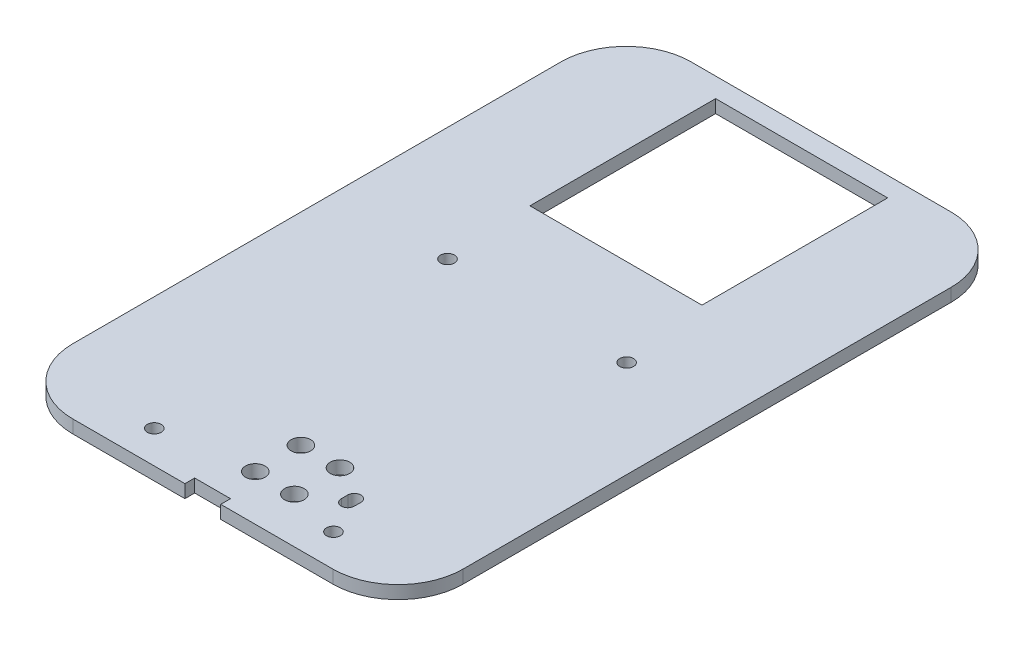
from build123d import *

# Parameters (mm, degrees)
TOP_DEPTH                 = 2.54
SKETCH7_R                 = 1.905
BUTTONLEDCUT_DEPTH        = 72.306909304
SKETCH8_W                 = 33.528
SKETCH8_H                 = 36.195
SOLARCUT_DEPTH            = 72.306909304
F_6_32_TAPPED_HOLE1_D     = 2.7051
F_6_32_TAPPED_HOLE1_DEPTH = 11.176
F_6_32_TAPPED_HOLE1_TIP   = 0.81269403
SKETCH13_W                = 12.446
SKETCH13_H                = 1.27
BODY_TABS_DEPTH           = 1.27
BODY_TABS_DRAFT           = 7
BODY_TABS_PROFILE_2_DEPTH = 1.27
BODY_TABS_PROFILE_2_DRAFT = 7
SKETCH14_W                = 6.985
SKETCH14_H                = 1.905
FLAT_HEAD_HOLE_DEPTH      = 73.383371188


with BuildPart() as part:
    # Sketch2 → top (new body)
    with BuildSketch(Plane(origin=(0, 0, 0), x_dir=(1, 0, 0), z_dir=(0, 1, 0))):
        with BuildLine():
            Line((-25.3365, -60.2615), (25.3365, -60.2615))
            ThreePointArc((25.3365, -60.2615), (34.316756121, -56.541756121), (38.0365, -47.5615))
            Line((38.0365, -47.5615), (38.0365, 47.5615))
            ThreePointArc((38.0365, 47.5615), (34.316756121, 56.541756121), (25.3365, 60.2615))
            Line((25.3365, 60.2615), (-25.3365, 60.2615))
            ThreePointArc((-25.3365, 60.2615), (-34.316756121, 56.541756121), (-38.0365, 47.5615))
            Line((-38.0365, 47.5615), (-38.0365, -47.5615))
            ThreePointArc((-38.0365, -47.5615), (-34.316756121, -56.541756121), (-25.3365, -60.2615))
        make_face()
    extrude(amount=TOP_DEPTH)

    # Sketch7 → ButtonLEDCut (cut, through all)
    with BuildSketch(Plane(origin=(0, 2.54, 0), x_dir=(1, 0, 0), z_dir=(0, 1, 0))):
        with Locations(Location((1.3335, -51.3715, 0), (0, 0, 270))):
            Circle(SKETCH7_R)
        with Locations(Location((8.9535, -51.3715, 0), (0, 0, 270))):
            Circle(SKETCH7_R)
        with Locations(Location((8.9535, -42.4815, 0), (0, 0, 270))):
            Circle(SKETCH7_R)
        with Locations(Location((1.3335, -42.4815, 0), (0, 0, 270))):
            Circle(SKETCH7_R)
        with BuildLine():
            Line((16.8275, -46.2915), (16.8275, -47.5615))
            ThreePointArc((16.8275, -47.5615), (15.5575, -48.8315), (14.2875, -47.5615))
            Line((14.2875, -47.5615), (14.2875, -46.2915))
            ThreePointArc((14.2875, -46.2915), (15.5575, -45.0215), (16.8275, -46.2915))
        make_face()
    extrude(amount=-BUTTONLEDCUT_DEPTH, mode=Mode.SUBTRACT)

    # Sketch8 → SolarCut (cut, through all)
    with BuildSketch(Plane(origin=(0, 2.54, 0), x_dir=(1, 0, 0), z_dir=(0, 1, 0))):
        with Locations((0, 38.354)):
            Rectangle(SKETCH8_W, SKETCH8_H)
    extrude(amount=-SOLARCUT_DEPTH, mode=Mode.SUBTRACT)

    # #6-32 Tapped Hole1
    with Locations(Plane(origin=(0, 2.54, 0), x_dir=(1, 0, 0), z_dir=(0, 1, 0))):
        with Locations((-15.8115, 3.2385), (19.1135, 3.2385), (19.1135, -53.9115), (-15.8115, -53.9115)):
            Hole(F_6_32_TAPPED_HOLE1_D / 2, depth=F_6_32_TAPPED_HOLE1_DEPTH)
            with Locations((0, 0, -(F_6_32_TAPPED_HOLE1_DEPTH + F_6_32_TAPPED_HOLE1_TIP / 2))):  # 118° drill point
                Cone(0, F_6_32_TAPPED_HOLE1_D / 2, F_6_32_TAPPED_HOLE1_TIP, mode=Mode.SUBTRACT)


with BuildPart() as body_tabs_tool:
    # Sketch13 → Body Tabs (with draft: the straight prism first)
    with BuildSketch(Plane(origin=(0, 0, -60.2615), x_dir=(-1, 0, 0), z_dir=(0, 0, -1))):
        with Locations((-12.7, 0.635)):
            Rectangle(SKETCH13_W, SKETCH13_H)
    extrude(amount=BODY_TABS_DEPTH)
    # Body Tabs: the draft: its side faces are tilted about the plane it starts from
    body_tabs_sides = [body_tabs_tool.faces().sort_by_distance(p)[0] for p in [
        (12.7, 0, -60.8965),
        (6.477, 0.635, -60.8965),
        (12.7, 1.27, -60.8965),
        (18.923, 0.635, -60.8965),
    ]]
    draft(body_tabs_sides, Plane(origin=(0, 0, -60.2615), x_dir=(-1, 0, 0), z_dir=(0, 0, -1)), BODY_TABS_DRAFT)


with BuildPart() as part_1:
    add(part.part)

    # Body Tabs: add body_tabs_tool
    add(body_tabs_tool.part)


with BuildPart() as body_tabs_profile_2_tool:
    # Sketch13 → Body Tabs profile 2 (with draft: the straight prism first)
    with BuildSketch(Plane(origin=(0, 0, -60.2615), x_dir=(-1, 0, 0), z_dir=(0, 0, -1))):
        with Locations((12.7, 0.635)):
            Rectangle(SKETCH13_W, SKETCH13_H)
    extrude(amount=BODY_TABS_PROFILE_2_DEPTH)
    # Body Tabs profile 2: the draft: its side faces are tilted about the plane it starts from
    body_tabs_profile_2_sides = [body_tabs_profile_2_tool.faces().sort_by_distance(p)[0] for p in [
        (-18.923, 0.635, -60.8965),
        (-12.7, 1.27, -60.8965),
        (-6.477, 0.635, -60.8965),
        (-12.7, 0, -60.8965),
    ]]
    draft(body_tabs_profile_2_sides, Plane(origin=(0, 0, -60.2615), x_dir=(-1, 0, 0), z_dir=(0, 0, -1)), BODY_TABS_PROFILE_2_DRAFT)


with BuildPart() as part_2:
    add(part_1.part)

    # Body Tabs profile 2: add body_tabs_profile_2_tool
    add(body_tabs_profile_2_tool.part)

    # Sketch14 → Flat Head Hole (cut, through all)
    with BuildSketch(Plane(origin=(0, 2.54, 0), x_dir=(1, 0, 0), z_dir=(0, 1, 0))):
        with Locations((0, -59.309)):
            Rectangle(SKETCH14_W, SKETCH14_H)
    extrude(amount=-FLAT_HEAD_HOLE_DEPTH, mode=Mode.SUBTRACT)


solid = part_2.part
